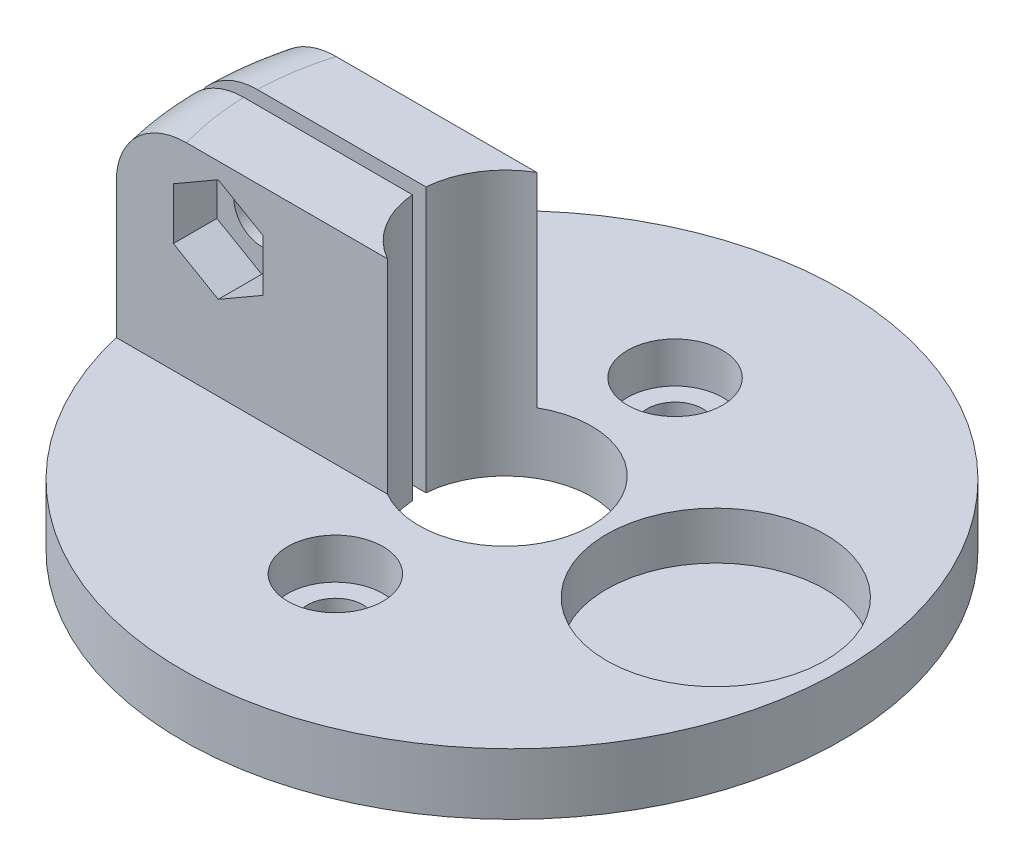
from build123d import *

# Parameters (mm, degrees)
BOSS_EXTRUDE2_DEPTH                     = 9
SKETCH4_R                               = 16.1
CUT_EXTRUDE1_DEPTH                      = 7
CBORE_FOR_M8_HEX_HEAD_BOLT1_D           = 8.2
CBORE_FOR_M8_HEX_HEAD_BOLT1_DEPTH       = 10
CBORE_FOR_M8_HEX_HEAD_BOLT1_CBORE_D     = 14
CBORE_FOR_M8_HEX_HEAD_BOLT1_CBORE_DEPTH = 6
CBORE_FOR_M8_HEX_HEAD_BOLT1_TIP         = 2.463528538
BOSS_EXTRUDE3_DEPTH                     = 30
SKETCH8_R                               = 4.1
CUT_EXTRUDE2_DEPTH                      = 87.668910227
CUT_EXTRUDE3_DEPTH                      = 6.4
FILLET1_R                               = 10


with BuildPart() as part:
    # Sketch2 → Boss-Extrude2 (new body)
    with BuildSketch(Plane(origin=(0, 0, 0), x_dir=(1, 0, 0), z_dir=(0, 1, 0))):
        with BuildLine():
            Line((-47.489689626, 1), (-12.660568708, 1))
            ThreePointArc((-12.660568708, 1), (0.500388556, 12.690138348), (12.7, 0))
            ThreePointArc((12.7, 0), (0.500388556, -12.690138348), (-12.660568708, -1))
            Line((-12.660568708, -1), (-47.489689626, -1))
            ThreePointArc((-47.489689626, -1), (1.500026575, -48.497422338), (49.5, 0))
            ThreePointArc((49.5, 0), (1.500026575, 48.497422338), (-47.489689626, 1))
        make_face()
    extrude(amount=BOSS_EXTRUDE2_DEPTH)

    # Sketch4 → Cut-Extrude1 (cut)
    with BuildSketch(Plane(origin=(0, 9, 0), x_dir=(1, 0, 0), z_dir=(0, 1, 0))):
        with Locations(Location((31, 0, 0), (0, 0, 270))):
            Circle(SKETCH4_R)
    extrude(amount=-CUT_EXTRUDE1_DEPTH, mode=Mode.SUBTRACT)

    # CBORE for M8 Hex Head Bolt1
    with Locations(Plane(origin=(0, 9, 25), x_dir=(0, 0, 1), z_dir=(0, 1, 0))):
        with Locations((0, 0), (-50, 0)):
            CounterBoreHole(CBORE_FOR_M8_HEX_HEAD_BOLT1_D / 2, CBORE_FOR_M8_HEX_HEAD_BOLT1_CBORE_D / 2, CBORE_FOR_M8_HEX_HEAD_BOLT1_CBORE_DEPTH, depth=CBORE_FOR_M8_HEX_HEAD_BOLT1_DEPTH)
            with Locations((0, 0, -(CBORE_FOR_M8_HEX_HEAD_BOLT1_DEPTH + CBORE_FOR_M8_HEX_HEAD_BOLT1_TIP / 2))):  # 118° drill point
                Cone(0, CBORE_FOR_M8_HEX_HEAD_BOLT1_D / 2, CBORE_FOR_M8_HEX_HEAD_BOLT1_TIP, mode=Mode.SUBTRACT)

    # Sketch7 → Boss-Extrude3 (add)
    with BuildSketch(Plane(origin=(0, 9, 0), x_dir=(1, 0, 0), z_dir=(0, 1, 0))):
        with BuildLine():
            Line((-46.236109069, -11), (-6.347440429, -11))
            ThreePointArc((-6.347440429, -11), (-10.738999154, -6.779667924), (-12.660568708, -1))
            Line((-12.660568708, -1), (-47.489689626, -1))
            ThreePointArc((-47.489689626, -1), (-47.123353312, -6.032650003), (-46.236109069, -11))
        make_face()
        with BuildLine():
            Line((-47.489689626, 1), (-12.660568708, 1))
            ThreePointArc((-12.660568708, 1), (-10.738999154, 6.779667924), (-6.347440429, 11))
            Line((-6.347440429, 11), (-46.236109069, 11))
            ThreePointArc((-46.236109069, 11), (-47.123353312, 6.032650003), (-47.489689626, 1))
        make_face()
    extrude(amount=BOSS_EXTRUDE3_DEPTH)

    # Sketch8 → Cut-Extrude2 (cut, through all)
    with BuildSketch(Plane(origin=(0, 0, -11), x_dir=(-1, 0, 0), z_dir=(0, 0, -1))):
        with Locations((31.236109069, 29)):
            Circle(SKETCH8_R)
    extrude(amount=-CUT_EXTRUDE2_DEPTH, mode=Mode.SUBTRACT)

    # Sketch9 → Cut-Extrude3 (cut)
    with BuildSketch(Plane.XY.offset(11)):
        Polygon((-24.636109069, 25.189488223), (-24.636109069, 32.810511777), (-31.236109069, 36.621023553), (-37.836109069, 32.810511777), (-37.836109069, 25.189488223), (-31.236109069, 21.378976447), align=None)
    extrude(amount=-CUT_EXTRUDE3_DEPTH, mode=Mode.SUBTRACT)

    # Fillet1
    fillet1_edges = [part.edges().sort_by_distance(p)[0] for p in [
        (-47.123353312, 39, 6.032650003),
        (-47.123353312, 39, -6.032650003),
    ]]
    fillet(fillet1_edges, radius=FILLET1_R)


solid = part.part
